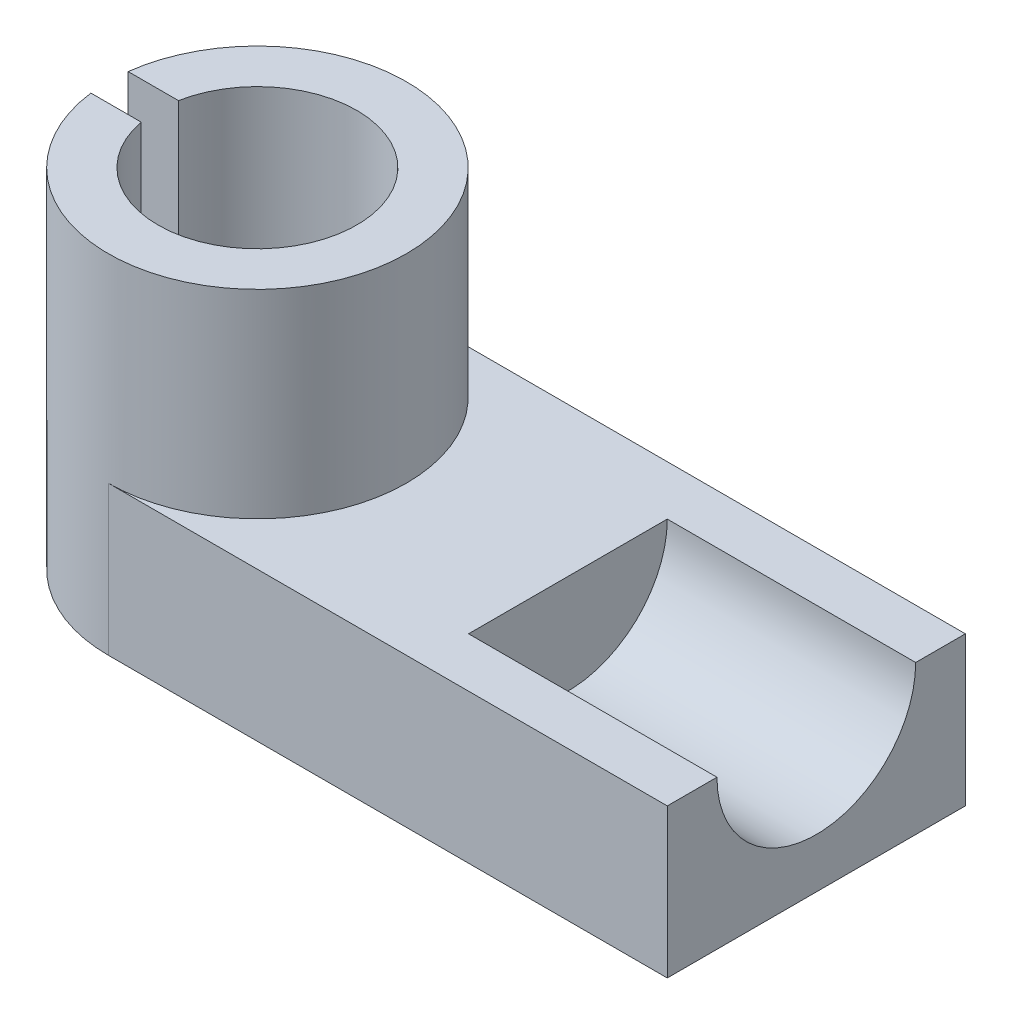
from build123d import *

# Parameters (mm, degrees)
SKETCH1_W                = 90
SKETCH1_H                = 48
BOSS_EXTRUDE1_DEPTH      = 24
SKETCH8_R                = 16
CUT_EXTRUDE1_DEPTH       = 40
BOSS_EXTRUDE2_DEPTH      = 32
BOSS_EXTRUDE2_DEPTH_BACK = 24
SKETCH9_R                = 24
SKETCH9_R_2              = 16
CUT_EXTRUDE2_DEPTH       = 32
CUT_EXTRUDE2_DEPTH_BACK  = 24
SKETCH10_R               = 16
SKETCH11_W               = 22
SKETCH11_H               = 6
CUT_EXTRUDE3_DEPTH       = 93.048900048


with BuildPart() as part:
    # Sketch1 → Boss-Extrude1 (new body)
    with BuildSketch(Plane(origin=(0, 0, 0), x_dir=(1, 0, 0), z_dir=(0, 1, 0))):
        Rectangle(SKETCH1_W, SKETCH1_H)
    extrude(amount=BOSS_EXTRUDE1_DEPTH)

    # Sketch8 → Cut-Extrude1 (cut)
    with BuildSketch(Plane(origin=(45, 0, 0), x_dir=(0, 0, -1), z_dir=(1, 0, 0))):
        with Locations((0, 24)):
            Circle(SKETCH8_R)
    extrude(amount=-CUT_EXTRUDE1_DEPTH, mode=Mode.SUBTRACT)

    # Sketch9 → Boss-Extrude2 (add, two sides: drawn at the far end of the back side and taken through both)
    with BuildSketch(Plane(origin=(0, 24, 0), x_dir=(1, 0, 0), z_dir=(0, 1, 0)).offset(-BOSS_EXTRUDE2_DEPTH_BACK)):
        with Locations(Location((-45, 0, 0), (0, 0, 270))):
            Circle(SKETCH9_R)
        with Locations(Location((-45, 0, 0), (0, 0, 270))):
            Circle(SKETCH9_R_2, mode=Mode.SUBTRACT)
    extrude(amount=BOSS_EXTRUDE2_DEPTH + BOSS_EXTRUDE2_DEPTH_BACK)

    # Sketch10 → Cut-Extrude2 (cut, two sides: drawn at the far end of the back side and taken through both)
    with BuildSketch(Plane(origin=(0, 24, 0), x_dir=(1, 0, 0), z_dir=(0, 1, 0)).offset(-CUT_EXTRUDE2_DEPTH_BACK)):
        with Locations(Location((-45, 0, 0), (0, 0, 270))):
            Circle(SKETCH10_R)
    extrude(amount=CUT_EXTRUDE2_DEPTH + CUT_EXTRUDE2_DEPTH_BACK, mode=Mode.SUBTRACT)

    # Sketch11 → Cut-Extrude3 (cut, through all)
    with BuildSketch(Plane(origin=(0, 56, 0), x_dir=(1, 0, 0), z_dir=(0, 1, 0))):
        with Locations((-69, 0)):
            Rectangle(SKETCH11_W, SKETCH11_H)
    extrude(amount=-CUT_EXTRUDE3_DEPTH, mode=Mode.SUBTRACT)


solid = part.part
